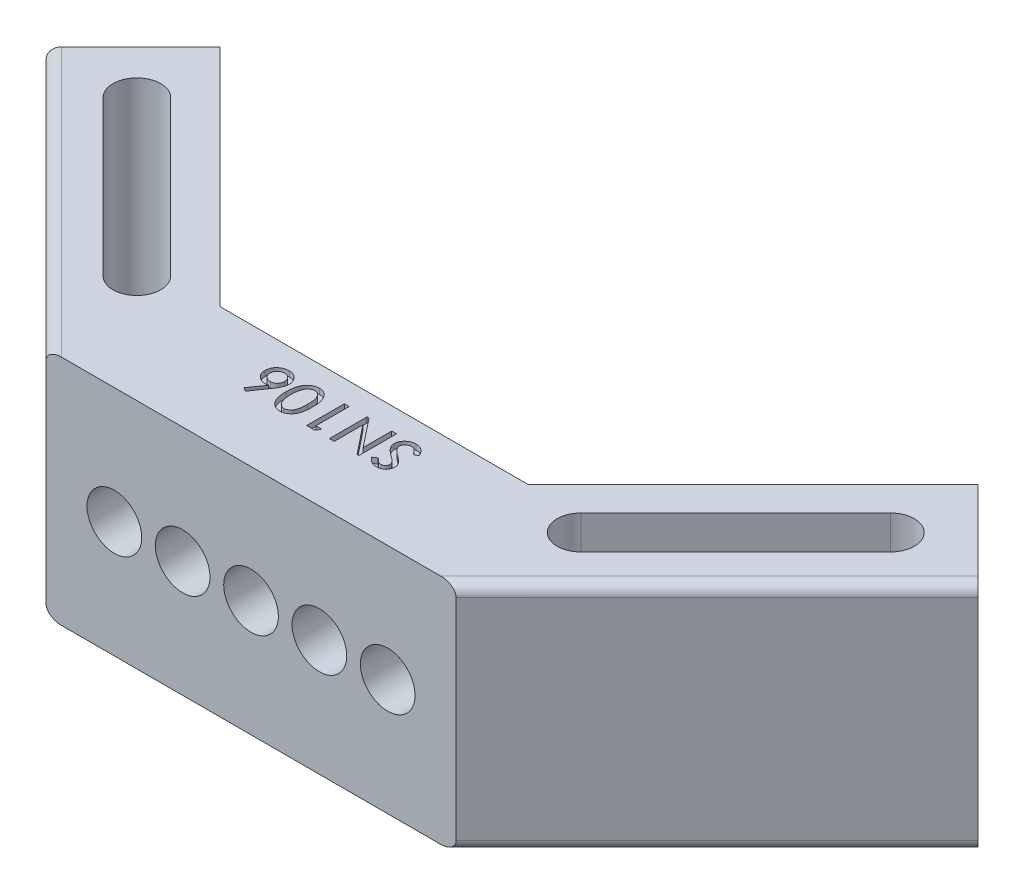
from build123d import *

# Parameters (mm, degrees)
BOSS_EXTRUDE1_DEPTH     = 10.795
CUT_EXTRUDE1_DEPTH      = 50.273729963
CUT_EXTRUDE1_DEPTH_BACK = 50.273729963
SKETCH2_R               = 2.54
FILLET1_R               = 1.016
CUT_EXTRUDE2_DEPTH      = 50.273729963
CUT_EXTRUDE2_DEPTH_BACK = 3.81
SKETCH2_4_R             = 2.54
CUT_EXTRUDE3_DEPTH      = 59.188407756
CUT_EXTRUDE4_DEPTH      = 0.5
CUT_EXTRUDE5_DEPTH      = 0.5


with BuildPart() as part:
    # Sketch1 → Boss-Extrude1 (new, symmetric)
    with BuildSketch(Plane(origin=(0, 0, 0), x_dir=(1, 0, 0), z_dir=(0, 1, 0))):
        Polygon((-43.296691527, 24.246691527), (-19.05, 0), (19.05, 0), (43.296691527, 24.246691527), (35.214461018, 32.328922036), (14.315538982, 11.43), (-14.315538982, 11.43), (-35.214461018, 32.328922036), align=None)
    extrude(amount=BOSS_EXTRUDE1_DEPTH, both=True)

    # Sketch2 → Cut-Extrude1 (cut, two sides: drawn at the far end of the back side and taken through both)
    with BuildSketch(Plane(origin=(0, 0, -11.43), x_dir=(-1, 0, 0), z_dir=(0, 0, -1)).offset(-CUT_EXTRUDE1_DEPTH_BACK)):
        with Locations((-12.7, 0)):
            Circle(SKETCH2_R)
        with Locations((12.7, 0)):
            Circle(SKETCH2_R)
        Circle(SKETCH2_R)
        with Locations((-6.35, 0)):
            Circle(SKETCH2_R)
        with Locations((6.35, 0)):
            Circle(SKETCH2_R)
    extrude(amount=CUT_EXTRUDE1_DEPTH + CUT_EXTRUDE1_DEPTH_BACK, mode=Mode.SUBTRACT)

    # Fillet1
    fillet1_edges = [part.edges().sort_by_distance(p)[0] for p in [
        (-31.173345763, -10.795, -12.123345763),
        (31.173345763, -10.795, -12.123345763),
        (-31.173345763, 10.795, -12.123345763),
        (31.173345763, 10.795, -12.123345763),
    ]]
    fillet(fillet1_edges, radius=FILLET1_R)

    # Sketch2<4> → Cut-Extrude2 (cut, two sides: drawn at the far end of the back side and taken through both)
    with BuildSketch(Plane(origin=(0, 0, -11.43), x_dir=(-1, 0, 0), z_dir=(0, 0, -1)).offset(-CUT_EXTRUDE2_DEPTH_BACK)):
        with BuildLine():
            Line((-12.7, 6.35), (12.7, 6.35))
            ThreePointArc((12.7, 6.35), (19.05, 0), (12.7, -6.35))
            Line((12.7, -6.35), (-12.7, -6.35))
            ThreePointArc((-12.7, -6.35), (-19.05, 0), (-12.7, 6.35))
        make_face()
        Circle(SKETCH2_4_R, mode=Mode.SUBTRACT)
        with Locations((-12.7, 0)):
            Circle(SKETCH2_4_R, mode=Mode.SUBTRACT)
        with Locations((12.7, 0)):
            Circle(SKETCH2_4_R, mode=Mode.SUBTRACT)
        with Locations((-6.35, 0)):
            Circle(SKETCH2_4_R, mode=Mode.SUBTRACT)
        with Locations((6.35, 0)):
            Circle(SKETCH2_4_R, mode=Mode.SUBTRACT)
    extrude(amount=CUT_EXTRUDE2_DEPTH + CUT_EXTRUDE2_DEPTH_BACK, mode=Mode.SUBTRACT)

    # Sketch5 → Cut-Extrude3 (cut, through all)
    with BuildSketch(Plane(origin=(0, 10.795, 0), x_dir=(1, 0, 0), z_dir=(0, 1, 0))):
        with BuildLine():
            ThreePointArc((-22.208240877, 8.456591988), (-19.065151234, 8.456591988), (-19.065151234, 11.599681631))
            Line((-19.065151234, 11.599681631), (-33.433561028, 25.968091424))
            ThreePointArc((-33.433561028, 25.968091424), (-36.57665067, 25.968091424), (-36.57665067, 22.825001782))
            Line((-36.57665067, 22.825001782), (-22.208240877, 8.456591988))
        make_face()
    cut_extrude3 = extrude(amount=-CUT_EXTRUDE3_DEPTH, mode=Mode.SUBTRACT)

    # Mirror1: Cut-Extrude3 across plane
    add(cut_extrude3.mirror(Plane(origin=(0, 0, 0), x_dir=(0, 0, 1), z_dir=(1, 0, 0))), mode=Mode.SUBTRACT)

    # Sketch6 → Cut-Extrude4 (cut)
    # profile 1 of 5: a face of its own
    with BuildSketch(Plane.XZ.offset(10.795)):
        with BuildLine():
            Line((6.142528045, -5.801234276), (6.490985577, -6.010168571))
            Line((6.490985577, -6.010168571), (5.552884615, -7.359126904))
            add(Edge.make_bspline(
                [(5.552884615, -7.359126904), (5.569865057, -7.354125421), (5.606651179, -7.343290298), (5.667993392, -7.333216842), (5.739058295, -7.328140552), (5.78962135, -7.327314516), (5.81650641, -7.326875302)],
                knots=[0, 0, 0, 0, 0.796048766, 1.724545677, 2.790110166, 4, 4, 4, 4], degree=3))
            add(Edge.make_bspline(
                [(5.81650641, -7.326875302), (5.854881834, -7.327787062), (5.93028817, -7.329578639), (6.040666259, -7.344589346), (6.146079588, -7.369232608), (6.246737591, -7.403521121), (6.342339379, -7.448148422), (6.433620482, -7.501264229), (6.518782792, -7.566053626), (6.598427218, -7.639134427), (6.67193822, -7.718048884), (6.735078142, -7.802902886), (6.789478059, -7.890656685), (6.834298152, -7.982293881), (6.867609478, -8.078297481), (6.89237983, -8.177493357), (6.907546882, -8.280635532), (6.909343922, -8.350695683), (6.91025641, -8.386270334)],
                knots=[0, 0, 0, 0, 1.085768624, 2.13349656, 3.1458852, 4.145750037, 5.137155722, 6.127501693, 7.128940571, 8.158980511, 9.184145427, 10.176323106, 11.147419034, 12.102959344, 13.056918676, 14.017869493, 14.993527694, 16, 16, 16, 16], degree=3))
            add(Edge.make_bspline(
                [(6.91025641, -8.386270334), (6.908537041, -8.434779697), (6.905154477, -8.530213554), (6.877330773, -8.6699623), (6.833299717, -8.803639336), (6.770476395, -8.929943927), (6.691131049, -9.048095581), (6.593361861, -9.154390341), (6.479015494, -9.249035256), (6.350342899, -9.331039887), (6.210193634, -9.397355779), (6.062274629, -9.445344451), (5.908142323, -9.475124846), (5.803084579, -9.478840455), (5.74989984, -9.480721455)],
                knots=[0, 0, 0, 0, 0.981999396, 1.931915476, 2.875165147, 3.825883243, 4.780566088, 5.74908454, 6.740839944, 7.779754303, 8.832355466, 9.872951476, 10.923196738, 12, 12, 12, 12], degree=3))
            add(Edge.make_bspline(
                [(5.74989984, -9.480721455), (5.701632194, -9.478955756), (5.605988813, -9.475456984), (5.465492316, -9.447878033), (5.330497672, -9.403457947), (5.202156658, -9.342008962), (5.083844073, -9.263514307), (4.977610712, -9.1701787), (4.88482725, -9.062396412), (4.806825406, -8.941472574), (4.744928771, -8.810936599), (4.699412226, -8.674511366), (4.672016987, -8.533198073), (4.6684583, -8.43733661), (4.666666667, -8.389074821)],
                knots=[0, 0, 0, 0, 1.013919762, 2.009103873, 2.997048414, 3.994509061, 4.990420291, 5.971920342, 6.957603089, 7.969950955, 8.9872563, 9.986070715, 10.986080238, 12, 12, 12, 12], degree=3))
            add(Edge.make_bspline(
                [(4.666666667, -8.389074821), (4.667834773, -8.352095171), (4.670203712, -8.27709986), (4.687021537, -8.163715189), (4.714501732, -8.048317141), (4.746843779, -7.951352379), (4.778225804, -7.871222227), (4.807262385, -7.807934321), (4.839416841, -7.741142016), (4.875859449, -7.671533386), (4.917565635, -7.599744022), (4.962383834, -7.524154776), (5.012206468, -7.446155356), (5.047077929, -7.393205514), (5.064903846, -7.366138122)],
                knots=[0, 0, 0, 0, 1.194305989, 2.422071347, 3.694670561, 5.022004315, 5.720134447, 6.47362152, 7.270449589, 8.114647718, 9.010750929, 9.951985565, 10.953076949, 12, 12, 12, 12], degree=3))
            Line((5.064903846, -7.366138122), (6.142528045, -5.801234276))
        make_face()
        with BuildLine():
            add(Edge.make_bspline(
                [(5.747095353, -7.730721455), (5.72555809, -7.73118182), (5.682984649, -7.732091837), (5.620562068, -7.741676672), (5.560309592, -7.756198629), (5.502821928, -7.777423279), (5.44783817, -7.804158674), (5.395386084, -7.836749861), (5.345495997, -7.875660121), (5.298311968, -7.919828336), (5.255908486, -7.969102635), (5.217241816, -8.020938444), (5.185880586, -8.077198153), (5.160780419, -8.136652887), (5.139982135, -8.198881537), (5.125430153, -8.264645836), (5.116934248, -8.333928803), (5.115908522, -8.381104727), (5.115384615, -8.405200622)],
                knots=[0, 0, 0, 0, 1.000668136, 1.978054791, 2.929484158, 3.878303629, 4.821130496, 5.767956646, 6.743892455, 7.758622191, 8.767575263, 9.763037712, 10.760455477, 11.753542685, 12.760386935, 13.807023548, 14.879900473, 16, 16, 16, 16], degree=3))
            add(Edge.make_bspline(
                [(5.115384615, -8.405200622), (5.115840612, -8.429070815), (5.116733794, -8.475826458), (5.126199513, -8.544384352), (5.14135138, -8.60978121), (5.163543793, -8.671826507), (5.19063223, -8.73109363), (5.224784285, -8.786881564), (5.264790251, -8.839432398), (5.310150613, -8.888233367), (5.359761664, -8.932306676), (5.412389195, -8.970556252), (5.466102602, -9.004106931), (5.52266269, -9.030008655), (5.580421655, -9.051343465), (5.640675088, -9.065840307), (5.702609527, -9.075517099), (5.744720651, -9.076419006), (5.766025641, -9.076875302)],
                knots=[0, 0, 0, 0, 1.099969797, 2.154561419, 3.184363179, 4.189745603, 5.187708984, 6.183808971, 7.198903794, 8.22825443, 9.251098181, 10.253299465, 11.225387826, 12.165412448, 13.116428293, 14.059905273, 15.018461259, 16, 16, 16, 16], degree=3))
            add(Edge.make_bspline(
                [(5.766025641, -9.076875302), (5.789670329, -9.076486125), (5.83624061, -9.075719606), (5.904698153, -9.065151838), (5.970605823, -9.049856491), (6.034220649, -9.02928062), (6.094083135, -9.000377302), (6.151987308, -8.966708885), (6.207463189, -8.926876593), (6.258792703, -8.880493654), (6.306349033, -8.830652282), (6.347728475, -8.777198744), (6.383191575, -8.721463723), (6.412172891, -8.663268557), (6.433743447, -8.602147257), (6.450346895, -8.53893007), (6.459170212, -8.472754489), (6.460742946, -8.42789256), (6.461538462, -8.405200622)],
                knots=[0, 0, 0, 0, 1.054506433, 2.076942642, 3.08409574, 4.073807639, 5.053850104, 6.045100359, 7.061397357, 8.095844899, 9.129029121, 10.132772442, 11.10813953, 12.073918953, 13.02762105, 13.996719216, 14.986705996, 16, 16, 16, 16], degree=3))
            add(Edge.make_bspline(
                [(6.461538462, -8.405200622), (6.460841927, -8.382260311), (6.459470795, -8.33710222), (6.449280146, -8.270640208), (6.433267549, -8.206714256), (6.410797541, -8.145217012), (6.381193793, -8.086575971), (6.344063154, -8.031330701), (6.302175669, -7.977369763), (6.253097003, -7.927831804), (6.20046858, -7.881314442), (6.143322326, -7.841722469), (6.084317271, -7.806866635), (6.022396956, -7.778525465), (5.957288013, -7.757704376), (5.889735571, -7.742377315), (5.819402639, -7.731888171), (5.771439613, -7.731114263), (5.747095353, -7.730721455)],
                knots=[0, 0, 0, 0, 1.007406841, 1.98308429, 2.946696416, 3.898367138, 4.853354566, 5.824321577, 6.818405618, 7.849339281, 8.882723662, 9.899554728, 10.89792352, 11.890309722, 12.883757414, 13.89487152, 14.931514512, 16, 16, 16, 16], degree=3))
        make_face(mode=Mode.SUBTRACT)
    # profile 2 of 5: a face of its own
    with BuildSketch(Plane.XZ.offset(10.795)):
        with BuildLine():
            add(Edge.make_bspline(
                [(1.75, -7.642380109), (1.750334058, -7.586750895), (1.750982811, -7.478716789), (1.757973411, -7.321554835), (1.770032714, -7.174034746), (1.785522465, -7.036152145), (1.806952125, -6.907812297), (1.831472094, -6.788951783), (1.861655425, -6.67955598), (1.89691059, -6.57942968), (1.936495051, -6.486794608), (1.980018353, -6.400490423), (2.027204843, -6.31942138), (2.077735827, -6.243615715), (2.134000258, -6.174762271), (2.192695032, -6.110503018), (2.256024, -6.052092346), (2.323406807, -5.999822683), (2.393110698, -5.95256591), (2.46595987, -5.912734751), (2.540266377, -5.878038017), (2.616977794, -5.84997137), (2.695537927, -5.828168936), (2.776228127, -5.812943082), (2.858664703, -5.802457909), (2.914530432, -5.801643562), (2.942608173, -5.801234276)],
                knots=[0, 0, 0, 0, 1.622528522, 3.151013738, 4.587225782, 5.939257941, 7.196658267, 8.381214254, 9.47772444, 10.503964975, 11.475138444, 12.414102326, 13.321377868, 14.209997518, 15.068075989, 15.912287155, 16.746865696, 17.577313739, 18.397854368, 19.200328723, 19.996378645, 20.787862277, 21.580050128, 22.371504404, 23.181529048, 24, 24, 24, 24], degree=3))
            add(Edge.make_bspline(
                [(2.942608173, -5.801234276), (2.973237922, -5.802040878), (3.033695605, -5.803632969), (3.123417723, -5.81229722), (3.210131667, -5.829801892), (3.295027194, -5.851753431), (3.376729209, -5.88176166), (3.456856126, -5.916269748), (3.532941685, -5.959977472), (3.60758101, -6.007787784), (3.678214939, -6.062922516), (3.745773489, -6.122830262), (3.808150339, -6.18955598), (3.867619238, -6.260803653), (3.921129774, -6.33936363), (3.972070251, -6.42248508), (4.017174791, -6.512238118), (4.059969158, -6.607035016), (4.096753461, -6.709396423), (4.130046774, -6.818737781), (4.157027361, -6.936421355), (4.179408665, -7.06208141), (4.196656635, -7.195929506), (4.209394703, -7.337647699), (4.2160452, -7.487368486), (4.217302923, -7.589790292), (4.217948718, -7.642380109)],
                knots=[0, 0, 0, 0, 0.875057392, 1.727207867, 2.570264412, 3.399251263, 4.229017074, 5.053828049, 5.887584622, 6.731829445, 7.583639997, 8.443960147, 9.308026848, 10.190032267, 11.091770676, 12.020167189, 12.972467704, 13.958579741, 14.989078804, 16.076606933, 17.221320015, 18.435081626, 19.720875061, 21.074561036, 22.497895074, 24, 24, 24, 24], degree=3))
            add(Edge.make_bspline(
                [(4.217948718, -7.642380109), (4.217296154, -7.69473541), (4.216025397, -7.79668845), (4.209470345, -7.94572042), (4.196402124, -8.08666786), (4.180311735, -8.219926374), (4.157742384, -8.345091248), (4.130261609, -8.462228606), (4.099444143, -8.571954321), (4.061771282, -8.673306741), (4.020056507, -8.767991687), (3.974798789, -8.856942179), (3.924954672, -8.940333506), (3.869764482, -9.017260885), (3.811858069, -9.090144906), (3.748719769, -9.156452449), (3.681500256, -9.217447378), (3.61036211, -9.272352899), (3.536119579, -9.321866651), (3.458306924, -9.363662241), (3.378885623, -9.400759989), (3.296082408, -9.428874598), (3.211575786, -9.452868111), (3.123942789, -9.468366639), (3.033996909, -9.478627987), (2.973252796, -9.48001947), (2.942608173, -9.480721455)],
                knots=[0, 0, 0, 0, 1.496607488, 2.914388442, 4.262485651, 5.541812885, 6.749953981, 7.895567619, 8.980172623, 10.005210728, 10.983286874, 11.936336572, 12.856292636, 13.757107149, 14.640766483, 15.514956722, 16.370989637, 17.232841377, 18.081413197, 18.918442167, 19.755471137, 20.583656588, 21.41504191, 22.264086897, 23.124254193, 24, 24, 24, 24], degree=3))
            add(Edge.make_bspline(
                [(2.942608173, -9.480721455), (2.914305371, -9.480240536), (2.858249654, -9.47928804), (2.775474392, -9.469946293), (2.694839409, -9.454442259), (2.616581533, -9.432712694), (2.540150912, -9.405124495), (2.465878998, -9.37170525), (2.394253958, -9.33123863), (2.324592257, -9.285770979), (2.257905619, -9.23405487), (2.195791617, -9.175602721), (2.136756827, -9.111811456), (2.081970768, -9.041993168), (2.030222744, -8.966598563), (1.983572671, -8.884917326), (1.940079665, -8.797821841), (1.899756188, -8.704641261), (1.863347889, -8.603756623), (1.834308991, -8.493194206), (1.806925593, -8.374160455), (1.786830121, -8.245451184), (1.769394702, -8.108037401), (1.759279418, -7.961027072), (1.75063513, -7.804907763), (1.750215591, -7.697549265), (1.75, -7.642380109)],
                knots=[0, 0, 0, 0, 0.82614074, 1.636230647, 2.42850654, 3.22151677, 4.005075515, 4.799112676, 5.596456327, 6.404618302, 7.226350817, 8.05679228, 8.892237205, 9.761873943, 10.645770802, 11.559890835, 12.505927976, 13.487073095, 14.523090282, 15.633895838, 16.822583925, 18.088023083, 19.435493537, 20.865857947, 22.389433785, 24, 24, 24, 24], degree=3))
        make_face()
        with BuildLine():
            add(Edge.make_bspline(
                [(2.198717949, -7.640977866), (2.19889818, -7.687958547), (2.199247094, -7.778909631), (2.204427917, -7.910519842), (2.21180401, -8.033069501), (2.222837456, -8.146525384), (2.237550198, -8.251056192), (2.254964185, -8.346517569), (2.274818745, -8.433092402), (2.299024788, -8.510922954), (2.325827162, -8.58183872), (2.355627953, -8.647125604), (2.386571139, -8.708262693), (2.421427695, -8.764038205), (2.458341648, -8.815214352), (2.49797956, -8.861596334), (2.538926415, -8.904200824), (2.59733787, -8.951509091), (2.672180451, -9.000969834), (2.76508861, -9.043859314), (2.858696861, -9.072170604), (2.921850726, -9.075317122), (2.953125, -9.076875302)],
                knots=[0, 0, 0, 0, 1.564601651, 3.028951736, 4.386019676, 5.653114642, 6.824348509, 7.900668805, 8.88431448, 9.780488761, 10.613163047, 11.407444027, 12.169849642, 12.89344098, 13.595615509, 14.26934431, 14.924332585, 15.560171042, 16.769153194, 17.901006317, 18.960562374, 20, 20, 20, 20], degree=3))
            add(Edge.make_bspline(
                [(2.953125, -9.076875302), (2.988565048, -9.075020955), (3.059224597, -9.071323802), (3.163289116, -9.044403856), (3.263069857, -8.999222517), (3.342131558, -8.948177818), (3.401865865, -8.898530617), (3.445004862, -8.856265981), (3.48476659, -8.809080431), (3.522302958, -8.757692488), (3.556243384, -8.701261518), (3.588969765, -8.641068293), (3.617464309, -8.575668681), (3.633932643, -8.530095286), (3.642327724, -8.506863282)],
                knots=[0, 0, 0, 0, 1.331887272, 2.655486065, 4.012646414, 5.436183829, 6.178803566, 6.930724497, 7.703763371, 8.496530827, 9.320959298, 10.178042319, 11.071218497, 12, 12, 12, 12], degree=3))
            add(Edge.make_bspline(
                [(3.642327724, -8.506863282), (3.652441861, -8.476339728), (3.67306023, -8.414115346), (3.698892212, -8.31723611), (3.720277913, -8.215580672), (3.738692194, -8.109690404), (3.752674184, -7.999031835), (3.762338677, -7.883711554), (3.767882369, -7.76372885), (3.768776306, -7.682349682), (3.769230769, -7.640977866)],
                knots=[0, 0, 0, 0, 0.877617242, 1.789083553, 2.735016418, 3.71249782, 4.722174671, 5.778575778, 6.870664861, 8, 8, 8, 8], degree=3))
            add(Edge.make_bspline(
                [(3.769230769, -7.640977866), (3.769121997, -7.599601813), (3.768909873, -7.518911583), (3.762605322, -7.400881519), (3.754980638, -7.288532649), (3.741826648, -7.182233934), (3.727105272, -7.081454889), (3.706912714, -6.986908023), (3.685255037, -6.897649467), (3.65819829, -6.81478165), (3.628617194, -6.737468684), (3.597417634, -6.665453226), (3.563683172, -6.598677651), (3.52651577, -6.53797982), (3.487287068, -6.48235848), (3.44585071, -6.432148143), (3.40158926, -6.38763143), (3.339710247, -6.337437885), (3.259940433, -6.285197292), (3.160194941, -6.238314112), (3.057197738, -6.210675066), (2.987634842, -6.206935575), (2.953125, -6.20508043)],
                knots=[0, 0, 0, 0, 1.353201578, 2.638969622, 3.865559904, 5.035676431, 6.141732754, 7.195734042, 8.19695873, 9.144657206, 10.044788335, 10.904062871, 11.710933862, 12.489720227, 13.229995877, 13.935715626, 14.616825307, 15.279494989, 16.538995736, 17.725922936, 18.871840505, 20, 20, 20, 20], degree=3))
            add(Edge.make_bspline(
                [(2.953125, -6.20508043), (2.921859744, -6.206669054), (2.858498715, -6.209888504), (2.764748402, -6.237806598), (2.672174702, -6.281036149), (2.597833642, -6.330531127), (2.539905255, -6.377789222), (2.498399384, -6.419424676), (2.460053178, -6.466068745), (2.42304776, -6.516832958), (2.389257698, -6.572975323), (2.356438605, -6.633471693), (2.327522698, -6.699321574), (2.300328962, -6.770291671), (2.276377876, -6.848264466), (2.25566518, -6.934707167), (2.237155882, -7.030062995), (2.223816293, -7.134804761), (2.21260258, -7.248433006), (2.204210323, -7.371174731), (2.199310267, -7.50304964), (2.198919697, -7.59399839), (2.198717949, -7.640977866)],
                knots=[0, 0, 0, 0, 1.039778295, 2.107176824, 3.232337611, 4.43520669, 5.071253539, 5.720927637, 6.389866065, 7.081397607, 7.811854436, 8.571243718, 9.372887587, 10.205834777, 11.102302774, 12.088086757, 13.166194718, 14.33675119, 15.604261439, 16.970055543, 18.43488556, 20, 20, 20, 20], degree=3))
        make_face(mode=Mode.SUBTRACT)
    # profile 3 of 5: a face of its own
    with BuildSketch(Plane.XZ.offset(10.795)):
        Polygon((-0.222956731, -5.890977866), (0.538461538, -5.890977866), (0.538461538, -9.390977866), (0.08974359, -9.390977866), (0.08974359, -6.294824019), (-0.448717949, -6.294824019), align=None)
    # profile 4 of 5: a face of its own
    with BuildSketch(Plane.XZ.offset(10.795)):
        Polygon((-4.307692308, -9.390977866), (-4.307692308, -5.890977866), (-4.141526442, -5.890977866), (-2.019230769, -8.550332834), (-2.019230769, -5.890977866), (-1.570512821, -5.890977866), (-1.570512821, -9.390977866), (-1.754206731, -9.390977866), (-3.858974359, -6.738634116), (-3.858974359, -9.390977866), align=None)
    # profile 5 of 5: a face of its own
    with BuildSketch(Plane.XZ.offset(10.795)):
        with BuildLine():
            Line((-7.134615385, -8.696867289), (-6.753205128, -8.493541968))
            add(Edge.make_bspline(
                [(-6.753205128, -8.493541968), (-6.725409617, -8.539583089), (-6.672284695, -8.627580425), (-6.585050876, -8.746123284), (-6.498316832, -8.847209188), (-6.411226397, -8.930736071), (-6.322569817, -8.995362245), (-6.233252176, -9.042068931), (-6.142714455, -9.071425636), (-6.081498979, -9.075078277), (-6.051382212, -9.076875302)],
                knots=[0, 0, 0, 0, 1.354943589, 2.589672558, 3.704607527, 4.708856974, 5.624398268, 6.459549776, 7.242129862, 8, 8, 8, 8], degree=3))
            add(Edge.make_bspline(
                [(-6.051382212, -9.076875302), (-6.023266588, -9.075971548), (-5.967577627, -9.074181473), (-5.885753554, -9.058657111), (-5.806526185, -9.035003457), (-5.731268385, -9.001321177), (-5.661740516, -8.960056254), (-5.600362691, -8.910973398), (-5.548285318, -8.855404372), (-5.50536149, -8.794103008), (-5.471715232, -8.728651817), (-5.446946422, -8.660908029), (-5.432409601, -8.59067645), (-5.430468422, -8.543387474), (-5.429487179, -8.519483475)],
                knots=[0, 0, 0, 0, 1.0888553, 2.156709112, 3.216967111, 4.287545289, 5.343926646, 6.34269433, 7.323221176, 8.28571565, 9.233736345, 10.167849744, 11.073870434, 12, 12, 12, 12], degree=3))
            add(Edge.make_bspline(
                [(-5.429487179, -8.519483475), (-5.430861992, -8.492240461), (-5.433640174, -8.43718856), (-5.455938534, -8.355408304), (-5.492177438, -8.27442823), (-5.525699241, -8.22386726), (-5.54306891, -8.197668571)],
                knots=[0, 0, 0, 0, 0.941861274, 1.903286225, 2.913566088, 4, 4, 4, 4], degree=3))
            add(Edge.make_bspline(
                [(-5.54306891, -8.197668571), (-5.558088529, -8.178597827), (-5.589706103, -8.138452292), (-5.643225687, -8.078012565), (-5.705850625, -8.014964963), (-5.777479329, -7.949593915), (-5.856852782, -7.880434653), (-5.945319272, -7.809274633), (-6.042253404, -7.734911239), (-6.110182152, -7.685022458), (-6.145332532, -7.659207032)],
                knots=[0, 0, 0, 0, 0.718593868, 1.512701116, 2.388487339, 3.348232282, 4.383172848, 5.504845107, 6.708858268, 8, 8, 8, 8], degree=3))
            add(Edge.make_bspline(
                [(-6.145332532, -7.659207032), (-6.181176719, -7.633149467), (-6.249951677, -7.583152297), (-6.346849586, -7.509856213), (-6.433727993, -7.442273162), (-6.50992068, -7.380350321), (-6.575436306, -7.323549484), (-6.630136857, -7.27210373), (-6.675669048, -7.227424866), (-6.700136749, -7.19736283), (-6.711137821, -7.183846455)],
                knots=[0, 0, 0, 0, 1.435833971, 2.754963323, 3.936484598, 5.002077172, 5.935979083, 6.744956812, 7.435712417, 8, 8, 8, 8], degree=3))
            add(Edge.make_bspline(
                [(-6.711137821, -7.183846455), (-6.727197898, -7.163095272), (-6.758749213, -7.122327902), (-6.79869427, -7.056934402), (-6.833066097, -6.990685052), (-6.861376393, -6.922966427), (-6.883315168, -6.853994863), (-6.898408007, -6.783528483), (-6.909054234, -6.711847192), (-6.909854241, -6.663419651), (-6.91025641, -6.639074821)],
                knots=[0, 0, 0, 0, 1.064105702, 2.090521257, 3.104283852, 4.09061442, 5.065433238, 6.036507983, 7.012940167, 8, 8, 8, 8], degree=3))
            add(Edge.make_bspline(
                [(-6.91025641, -6.639074821), (-6.908989932, -6.601109463), (-6.906482398, -6.525940834), (-6.884074123, -6.416205895), (-6.847761129, -6.311648096), (-6.798194277, -6.212807838), (-6.734898311, -6.121524941), (-6.659610332, -6.039602138), (-6.571922979, -5.968787506), (-6.474175901, -5.909118683), (-6.368816076, -5.86072687), (-6.257847488, -5.826235403), (-6.142615385, -5.805325454), (-6.064322685, -5.802608108), (-6.024739583, -5.801234276)],
                knots=[0, 0, 0, 0, 1.004530234, 1.988896367, 2.951881425, 3.928924249, 4.907494835, 5.884204368, 6.865296418, 7.88218147, 8.909671266, 9.927572845, 10.952225504, 12, 12, 12, 12], degree=3))
            add(Edge.make_bspline(
                [(-6.024739583, -5.801234276), (-5.97979523, -5.802842996), (-5.890782722, -5.806029073), (-5.759569916, -5.827620607), (-5.634098237, -5.866494681), (-5.533044648, -5.909404439), (-5.454544493, -5.953276288), (-5.39517322, -5.992900079), (-5.334320728, -6.037742929), (-5.273914395, -6.090040221), (-5.21159991, -6.147261615), (-5.150568275, -6.212517535), (-5.086957121, -6.282068082), (-5.0464137, -6.332226172), (-5.025641026, -6.357924981)],
                knots=[0, 0, 0, 0, 1.360590218, 2.69465552, 4.010645498, 5.328858611, 6.009843139, 6.729980544, 7.488405022, 8.296451933, 9.147430815, 10.048128915, 10.999946711, 12, 12, 12, 12], degree=3))
            Line((-5.025641026, -6.357924981), (-5.391626603, -6.608926584))
            add(Edge.make_bspline(
                [(-5.391626603, -6.608926584), (-5.410726399, -6.588533171), (-5.447450513, -6.549321756), (-5.501470922, -6.493713978), (-5.552581596, -6.443809972), (-5.600937645, -6.399838032), (-5.64545524, -6.361013975), (-5.687385282, -6.328646956), (-5.725416568, -6.300828973), (-5.772959048, -6.273258283), (-5.831242542, -6.245952682), (-5.902975847, -6.221383904), (-5.978220994, -6.208253403), (-6.029134927, -6.206146252), (-6.054887821, -6.20508043)],
                knots=[0, 0, 0, 0, 1.253377364, 2.409930098, 3.477532466, 4.457083962, 5.341772995, 6.126101147, 6.832963523, 7.453284126, 8.588253012, 9.715448048, 10.844445545, 12, 12, 12, 12], degree=3))
            add(Edge.make_bspline(
                [(-6.054887821, -6.20508043), (-6.082376285, -6.206365023), (-6.135816103, -6.208862377), (-6.2125796, -6.230248013), (-6.283143812, -6.263993816), (-6.345401229, -6.311753165), (-6.397147647, -6.370866451), (-6.435097436, -6.440110178), (-6.457306698, -6.519022609), (-6.460088065, -6.574426298), (-6.461538462, -6.603317609)],
                knots=[0, 0, 0, 0, 1.033513523, 2.009234674, 2.977584268, 3.963375862, 4.942860848, 5.915719707, 6.913112236, 8, 8, 8, 8], degree=3))
            add(Edge.make_bspline(
                [(-6.461538462, -6.603317609), (-6.460973342, -6.622038249), (-6.459844469, -6.659434247), (-6.45155258, -6.714828353), (-6.436225027, -6.768352201), (-6.41680192, -6.821133945), (-6.389616225, -6.872877016), (-6.35499362, -6.923663121), (-6.313893391, -6.974955404), (-6.282350477, -7.007200204), (-6.265925481, -7.023990686)],
                knots=[0, 0, 0, 0, 0.940834015, 1.879392378, 2.805520916, 3.734846727, 4.701501436, 5.734192883, 6.820151034, 8, 8, 8, 8], degree=3))
            add(Edge.make_bspline(
                [(-6.265925481, -7.023990686), (-6.257608805, -7.031814604), (-6.238520292, -7.049772137), (-6.203509907, -7.077270447), (-6.160855211, -7.111745981), (-6.109964858, -7.15263604), (-6.049165457, -7.197720639), (-5.980704978, -7.250011802), (-5.902849995, -7.30715544), (-5.848063226, -7.347217007), (-5.819310897, -7.368241487)],
                knots=[0, 0, 0, 0, 0.485581606, 1.114511607, 1.892484918, 2.819534315, 3.891398566, 5.11240712, 6.484579029, 8, 8, 8, 8], degree=3))
            add(Edge.make_bspline(
                [(-5.819310897, -7.368241487), (-5.780139092, -7.396793724), (-5.70435987, -7.45202902), (-5.596712884, -7.535344195), (-5.499630506, -7.61701356), (-5.41065826, -7.69418786), (-5.332805038, -7.770104406), (-5.264612133, -7.843202263), (-5.205223169, -7.91276794), (-5.141795044, -8.001462231), (-5.078379634, -8.110807055), (-5.021673151, -8.242970819), (-4.987834614, -8.376177199), (-4.983104075, -8.465084716), (-4.980769231, -8.508966648)],
                knots=[0, 0, 0, 0, 1.186540699, 2.295404303, 3.331123753, 4.291760032, 5.17774712, 5.991329992, 6.738459906, 7.414799035, 8.65800623, 9.82461674, 10.926299804, 12, 12, 12, 12], degree=3))
            add(Edge.make_bspline(
                [(-4.980769231, -8.508966648), (-4.981762698, -8.540100238), (-4.983737291, -8.601980629), (-4.998053634, -8.69347475), (-5.021874769, -8.782403896), (-5.056145788, -8.868392551), (-5.098891837, -8.95224774), (-5.151894077, -9.033236349), (-5.214979751, -9.111046296), (-5.285487377, -9.186147759), (-5.36345101, -9.255168932), (-5.447058155, -9.315916667), (-5.536053554, -9.366664987), (-5.629751416, -9.407838439), (-5.727601968, -9.441389689), (-5.830572197, -9.464369489), (-5.938152827, -9.477633769), (-6.011381558, -9.479681381), (-6.048577724, -9.480721455)],
                knots=[0, 0, 0, 0, 0.932646097, 1.853705421, 2.767602683, 3.685675702, 4.622099834, 5.5835355, 6.579838097, 7.620108014, 8.666886363, 9.695041649, 10.711275682, 11.730160242, 12.757671447, 13.80585424, 14.885494678, 16, 16, 16, 16], degree=3))
            add(Edge.make_bspline(
                [(-6.048577724, -9.480721455), (-6.075701591, -9.480119), (-6.129124394, -9.478932411), (-6.20843469, -9.471405668), (-6.285613488, -9.456939342), (-6.361083932, -9.438235841), (-6.434893126, -9.414419457), (-6.506089872, -9.383953935), (-6.575859762, -9.348960074), (-6.643802562, -9.307985887), (-6.710004912, -9.26000834), (-6.774843031, -9.204315844), (-6.837940291, -9.139929395), (-6.900378313, -9.067685508), (-6.961332208, -8.986771588), (-7.020659671, -8.897613108), (-7.07911821, -8.800497577), (-7.115751706, -8.732091577), (-7.134615385, -8.696867289)],
                knots=[0, 0, 0, 0, 0.916943493, 1.805999526, 2.689245248, 3.568702553, 4.433092864, 5.307568578, 6.183755457, 7.069823058, 7.986358083, 8.944343836, 9.955449961, 11.030835633, 12.170024038, 13.377301724, 14.649494474, 16, 16, 16, 16], degree=3))
        make_face()
    extrude(amount=-CUT_EXTRUDE4_DEPTH, mode=Mode.SUBTRACT)

    # Sketch7 → Cut-Extrude5 (cut)
    # profile 1 of 5: a face of its own
    with BuildSketch(Plane(origin=(0, 10.795, 0), x_dir=(1, 0, 0), z_dir=(0, 1, 0))):
        with BuildLine():
            Line((6.955128205, 8.696867289), (6.573717949, 8.493541968))
            add(Edge.make_bspline(
                [(6.573717949, 8.493541968), (6.545922437, 8.539583089), (6.492797515, 8.627580425), (6.405563696, 8.746123284), (6.318829653, 8.847209188), (6.231739217, 8.930736071), (6.143082637, 8.995362245), (6.053764997, 9.042068931), (5.963227276, 9.071425636), (5.9020118, 9.075078277), (5.871895032, 9.076875302)],
                knots=[0, 0, 0, 0, 1.354943589, 2.589672558, 3.704607527, 4.708856974, 5.624398268, 6.459549776, 7.242129862, 8, 8, 8, 8], degree=3))
            add(Edge.make_bspline(
                [(5.871895032, 9.076875302), (5.843777409, 9.075976115), (5.788084486, 9.074195085), (5.706289617, 9.058604042), (5.626860085, 9.035174676), (5.551935483, 9.00048938), (5.48244247, 8.95935991), (5.420674582, 8.910775821), (5.368082166, 8.855622919), (5.325239521, 8.794066052), (5.291507213, 8.728979828), (5.267412618, 8.661058448), (5.252956595, 8.590906704), (5.250989532, 8.543387851), (5.25, 8.519483475)],
                knots=[0, 0, 0, 0, 1.088711937, 2.156425153, 3.216543554, 4.290691142, 5.346933412, 6.339926723, 7.326538423, 8.288906172, 9.236802047, 10.159214894, 11.073992371, 12, 12, 12, 12], degree=3))
            add(Edge.make_bspline(
                [(5.25, 8.519483475), (5.251289441, 8.492214994), (5.253897944, 8.437051594), (5.277544855, 8.35570696), (5.312451573, 8.274232194), (5.346112616, 8.223827276), (5.363581731, 8.197668571)],
                knots=[0, 0, 0, 0, 0.942144539, 1.905933023, 2.913239343, 4, 4, 4, 4], degree=3))
            add(Edge.make_bspline(
                [(5.363581731, 8.197668571), (5.378599068, 8.178595314), (5.410211837, 8.138444487), (5.463771743, 8.078049168), (5.526108213, 8.014918591), (5.598480894, 7.950373777), (5.677065406, 7.880326252), (5.765885722, 7.809335441), (5.862751255, 7.734894267), (5.930689868, 7.685016671), (5.965845353, 7.659207032)],
                knots=[0, 0, 0, 0, 0.718605451, 1.5127255, 2.388525841, 3.34361075, 4.383114545, 5.504804886, 6.708837455, 8, 8, 8, 8], degree=3))
            add(Edge.make_bspline(
                [(5.965845353, 7.659207032), (6.00168954, 7.633149467), (6.070464497, 7.583152297), (6.167362407, 7.509856213), (6.254240814, 7.442273162), (6.3304335, 7.380350321), (6.395949126, 7.323549484), (6.450649678, 7.27210373), (6.496181868, 7.227424866), (6.520649569, 7.19736283), (6.531650641, 7.183846455)],
                knots=[0, 0, 0, 0, 1.435833971, 2.754963323, 3.936484598, 5.002077172, 5.935979083, 6.744956812, 7.435712417, 8, 8, 8, 8], degree=3))
            add(Edge.make_bspline(
                [(6.531650641, 7.183846455), (6.547710719, 7.163095272), (6.579262034, 7.122327902), (6.61920709, 7.056934402), (6.653578917, 6.990685052), (6.681889214, 6.922966427), (6.703827988, 6.853994863), (6.718920828, 6.783528483), (6.729567054, 6.711847192), (6.730367062, 6.663419651), (6.730769231, 6.639074821)],
                knots=[0, 0, 0, 0, 1.064105702, 2.090521257, 3.104283852, 4.09061442, 5.065433238, 6.036507983, 7.012940167, 8, 8, 8, 8], degree=3))
            add(Edge.make_bspline(
                [(6.730769231, 6.639074821), (6.729515083, 6.601104472), (6.727031963, 6.525925959), (6.704399939, 6.416046178), (6.668607851, 6.310920136), (6.617838539, 6.212306218), (6.554959306, 6.121066831), (6.479870762, 6.039381073), (6.392434284, 5.968791115), (6.294689139, 5.909117689), (6.189328785, 5.860727135), (6.078360338, 5.826235332), (5.963128198, 5.805325472), (5.884835503, 5.802608114), (5.845252404, 5.801234276)],
                knots=[0, 0, 0, 0, 1.004538361, 1.98891246, 2.957754601, 3.937604432, 4.916182936, 5.884154884, 6.865254872, 7.882148152, 8.909646262, 9.927556077, 10.952217026, 12, 12, 12, 12], degree=3))
            add(Edge.make_bspline(
                [(5.845252404, 5.801234276), (5.800288489, 5.802743512), (5.711198198, 5.805733871), (5.58029896, 5.828777748), (5.45446477, 5.866212331), (5.353568286, 5.909444093), (5.275055104, 5.953268186), (5.215686682, 5.992902428), (5.154833361, 6.03774224), (5.09442727, 6.090040421), (5.032112714, 6.147261557), (4.9710811, 6.212517551), (4.907469941, 6.282068077), (4.86692652, 6.33222617), (4.846153846, 6.357924981)],
                knots=[0, 0, 0, 0, 1.360687177, 2.696028959, 4.010076158, 5.328383209, 6.009416266, 6.72960499, 7.488083515, 8.296188009, 9.147227534, 10.04798982, 10.999875445, 12, 12, 12, 12], degree=3))
            Line((4.846153846, 6.357924981), (5.212139423, 6.608926584))
            add(Edge.make_bspline(
                [(5.212139423, 6.608926584), (5.231197788, 6.588493045), (5.267953877, 6.549084787), (5.322642771, 6.493896516), (5.373784064, 6.444057522), (5.421450494, 6.399573361), (5.466336542, 6.360962161), (5.508000192, 6.327888619), (5.546973362, 6.301260594), (5.593160244, 6.271920994), (5.651920246, 6.245083088), (5.723895671, 6.221771924), (5.798937681, 6.208126035), (5.849638961, 6.206106546), (5.875400641, 6.20508043)],
                knots=[0, 0, 0, 0, 1.253255604, 2.417037033, 3.484535688, 4.456276324, 5.340879413, 6.139846054, 6.840628373, 7.457335203, 8.592193832, 9.725986821, 10.844557802, 12, 12, 12, 12], degree=3))
            add(Edge.make_bspline(
                [(5.875400641, 6.20508043), (5.902885124, 6.206374437), (5.956317203, 6.208890094), (6.032932005, 6.230088186), (6.103119698, 6.264178759), (6.165194449, 6.311957616), (6.217718177, 6.370617564), (6.255574284, 6.440140864), (6.277829561, 6.519014042), (6.280604327, 6.574423361), (6.282051282, 6.603317609)],
                knots=[0, 0, 0, 0, 1.033786987, 2.00976631, 2.970458119, 3.95651055, 4.942051941, 5.915168215, 6.91282465, 8, 8, 8, 8], degree=3))
            add(Edge.make_bspline(
                [(6.282051282, 6.603317609), (6.28149088, 6.622039999), (6.28037143, 6.659439495), (6.272009308, 6.714807536), (6.256922644, 6.768510246), (6.23645815, 6.820995653), (6.209395004, 6.87268112), (6.175597302, 6.923883995), (6.134357789, 6.974921647), (6.102846717, 7.007188645), (6.086438301, 7.023990686)],
                knots=[0, 0, 0, 0, 0.941102048, 1.879927795, 2.806320176, 3.740133313, 4.70706341, 5.733547381, 6.819814909, 8, 8, 8, 8], degree=3))
            add(Edge.make_bspline(
                [(6.086438301, 7.023990686), (6.078121626, 7.031814604), (6.059033112, 7.049772137), (6.024022728, 7.077270447), (5.981368032, 7.111745981), (5.930477678, 7.15263604), (5.869678278, 7.197720639), (5.801217798, 7.250011802), (5.723362816, 7.30715544), (5.668576046, 7.347217007), (5.639823718, 7.368241487)],
                knots=[0, 0, 0, 0, 0.485581606, 1.114511607, 1.892484918, 2.819534315, 3.891398566, 5.11240712, 6.484579029, 8, 8, 8, 8], degree=3))
            add(Edge.make_bspline(
                [(5.639823718, 7.368241487), (5.600647247, 7.396788565), (5.524859001, 7.45201388), (5.417274927, 7.535398631), (5.320111394, 7.616717379), (5.231859623, 7.694677521), (5.153297125, 7.769840169), (5.085159515, 7.843236538), (5.025718972, 7.91275671), (4.962356185, 8.001482918), (4.898616052, 8.110606646), (4.843298524, 8.243258401), (4.808089766, 8.376047617), (4.80353079, 8.46506055), (4.801282051, 8.508966648)],
                knots=[0, 0, 0, 0, 1.186639563, 2.29559556, 3.331401308, 4.287832086, 5.178002532, 5.991653193, 6.738845359, 7.415240842, 8.658551622, 9.823054859, 10.926210341, 12, 12, 12, 12], degree=3))
            add(Edge.make_bspline(
                [(4.801282051, 8.508966648), (4.802275506, 8.540100251), (4.804250073, 8.601980667), (4.818566607, 8.693474603), (4.842387021, 8.782404443), (4.876660762, 8.868390481), (4.919396348, 8.952255726), (4.972439298, 9.033205208), (5.035257903, 9.11103726), (5.106262482, 9.185424514), (5.183899032, 9.254553913), (5.267788427, 9.31507764), (5.356348148, 9.366809454), (5.450294329, 9.407786722), (5.548106527, 9.441403888), (5.651087312, 9.464365547), (5.758665045, 9.477634804), (5.831894176, 9.47968173), (5.869090545, 9.480721455)],
                knots=[0, 0, 0, 0, 0.932738639, 1.853889356, 2.767877299, 3.686041414, 4.622558463, 5.584089528, 6.580490983, 7.61578374, 8.662665956, 9.690923261, 10.710750907, 11.729736566, 12.757349726, 13.805636525, 14.885384091, 16, 16, 16, 16], degree=3))
            add(Edge.make_bspline(
                [(5.869090545, 9.480721455), (5.896214412, 9.480119), (5.949637214, 9.478932411), (6.028947511, 9.471405668), (6.106126309, 9.456939342), (6.181596753, 9.438235841), (6.255405946, 9.414419457), (6.326602693, 9.383953935), (6.396372582, 9.348960074), (6.464315382, 9.307985887), (6.530517733, 9.26000834), (6.595355852, 9.204315844), (6.658453112, 9.139929395), (6.720891134, 9.067685508), (6.781845028, 8.986771588), (6.841172492, 8.897613108), (6.899631031, 8.800497577), (6.936264526, 8.732091577), (6.955128205, 8.696867289)],
                knots=[0, 0, 0, 0, 0.916943493, 1.805999526, 2.689245248, 3.568702553, 4.433092864, 5.307568578, 6.183755457, 7.069823058, 7.986358083, 8.944343836, 9.955449961, 11.030835633, 12.170024038, 13.377301724, 14.649494474, 16, 16, 16, 16], degree=3))
        make_face()
    # profile 2 of 5: a face of its own
    with BuildSketch(Plane(origin=(0, 10.795, 0), x_dir=(1, 0, 0), z_dir=(0, 1, 0))):
        Polygon((4.128205128, 9.390977866), (4.128205128, 5.890977866), (3.962039263, 5.890977866), (1.83974359, 8.550332834), (1.83974359, 5.890977866), (1.391025641, 5.890977866), (1.391025641, 9.390977866), (1.574719551, 9.390977866), (3.679487179, 6.738634116), (3.679487179, 9.390977866), align=None)
    # profile 3 of 5: a face of its own
    with BuildSketch(Plane(origin=(0, 10.795, 0), x_dir=(1, 0, 0), z_dir=(0, 1, 0))):
        Polygon((0.043469551, 5.890977866), (-0.717948718, 5.890977866), (-0.717948718, 9.390977866), (-0.269230769, 9.390977866), (-0.269230769, 6.294824019), (0.269230769, 6.294824019), align=None)
    # profile 4 of 5: a face of its own
    with BuildSketch(Plane(origin=(0, 10.795, 0), x_dir=(1, 0, 0), z_dir=(0, 1, 0))):
        with BuildLine():
            add(Edge.make_bspline(
                [(-1.929487179, 7.642380109), (-1.929820024, 7.586750652), (-1.930466421, 7.478716074), (-1.937473576, 7.321557433), (-1.949475503, 7.174025864), (-1.965186437, 7.035953116), (-1.985981936, 6.907432951), (-2.01210377, 6.788635779), (-2.041666608, 6.679048389), (-2.077057072, 6.578699599), (-2.116884293, 6.486313454), (-2.159279173, 6.399423792), (-2.207248145, 6.318960169), (-2.258445983, 6.243741734), (-2.313138476, 6.173611131), (-2.372968524, 6.110079872), (-2.436199286, 6.051410826), (-2.503346552, 5.99895724), (-2.573759685, 5.952875359), (-2.645716894, 5.911655363), (-2.720506077, 5.87844393), (-2.796608784, 5.849751377), (-2.875043288, 5.828212221), (-2.955710335, 5.812931245), (-3.038153153, 5.802460933), (-3.094018037, 5.801644573), (-3.122095353, 5.801234276)],
                knots=[0, 0, 0, 0, 1.622605109, 3.151162473, 4.587442309, 5.939538287, 7.20372481, 8.383107478, 9.486239959, 10.512528934, 11.483748244, 12.419707751, 13.330476935, 14.213498841, 15.072700274, 15.92158999, 16.756207925, 17.586695167, 18.403499641, 19.2093348, 20.002585959, 20.787710657, 21.579935901, 22.371427536, 23.181490415, 24, 24, 24, 24], degree=3))
            add(Edge.make_bspline(
                [(-3.122095353, 5.801234276), (-3.152731517, 5.80201154), (-3.213201864, 5.80354572), (-3.302787896, 5.812629688), (-3.389864801, 5.828555035), (-3.474185977, 5.852322446), (-3.556619955, 5.880520216), (-3.63604835, 5.916869037), (-3.713266346, 5.958826771), (-3.787678328, 6.007230744), (-3.858415308, 6.061941934), (-3.925441203, 6.122665584), (-3.988267508, 6.188992519), (-4.046907915, 6.261304443), (-4.101416121, 6.338751065), (-4.151425746, 6.422352243), (-4.197578861, 6.511302619), (-4.240034798, 6.606387504), (-4.277149587, 6.708558059), (-4.309407109, 6.8183864), (-4.336484753, 6.936189476), (-4.358892888, 7.062083659), (-4.376144672, 7.195928854), (-4.388881636, 7.337647887), (-4.395532446, 7.487368435), (-4.396790125, 7.589790275), (-4.397435897, 7.642380109)],
                knots=[0, 0, 0, 0, 0.874832558, 1.726764085, 2.568361456, 3.398879789, 4.226201588, 5.053523386, 5.889679481, 6.733707388, 7.585299078, 8.4404393, 9.313717912, 10.191269597, 11.096596538, 12.015593249, 12.970707924, 13.956566593, 14.986800884, 16.072143337, 17.223061702, 18.436511454, 19.721974523, 21.075312687, 22.498281019, 24, 24, 24, 24], degree=3))
            add(Edge.make_bspline(
                [(-4.397435897, 7.642380109), (-4.396782502, 7.694735202), (-4.395510127, 7.796687836), (-4.388966535, 7.945722679), (-4.375857992, 8.08666001), (-4.359906802, 8.219953422), (-4.336868841, 8.344946776), (-4.311081981, 8.462290936), (-4.278377775, 8.571169614), (-4.241956283, 8.672888531), (-4.200730937, 8.767895408), (-4.153785212, 8.856321484), (-4.104592007, 8.939999833), (-4.050060208, 9.017704151), (-3.991471708, 9.089634494), (-3.928478795, 9.156247305), (-3.861485674, 9.217011905), (-3.790212069, 9.272106234), (-3.715479627, 9.320772857), (-3.638364874, 9.363854803), (-3.558372006, 9.399962028), (-3.47592898, 9.428979517), (-3.391043214, 9.45281715), (-3.303435357, 9.468380541), (-3.213482705, 9.478624419), (-3.152739512, 9.480018274), (-3.122095353, 9.480721455)],
                knots=[0, 0, 0, 0, 1.49659969, 2.914373258, 4.262463443, 5.541784011, 6.749918813, 7.89402581, 8.97408983, 9.996834451, 10.981022981, 11.93120719, 12.856888794, 13.753851156, 14.64171265, 15.506454614, 16.371918745, 17.224394982, 18.078544691, 18.918788586, 19.746969722, 20.583674387, 21.415055378, 22.264095942, 23.124258755, 24, 24, 24, 24], degree=3))
            add(Edge.make_bspline(
                [(-3.122095353, 9.480721455), (-3.09379246, 9.480240728), (-3.037736562, 9.479288614), (-2.954962623, 9.469944069), (-2.874322736, 9.454450402), (-2.796083047, 9.432682391), (-2.719785436, 9.405308632), (-2.645951414, 9.371465345), (-2.574212715, 9.331364032), (-2.504974112, 9.284993568), (-2.438313207, 9.233367387), (-2.375492482, 9.175398345), (-2.316719786, 9.111380215), (-2.26121611, 9.041954202), (-2.209744799, 8.966568994), (-2.163065245, 8.884918341), (-2.119409324, 8.797658264), (-2.07933584, 8.704120925), (-2.043193198, 8.603132275), (-2.012518016, 8.493223081), (-1.986781079, 8.374025208), (-1.966139854, 8.245481206), (-1.949205111, 8.107990437), (-1.937551448, 7.961091101), (-1.930454678, 7.804878267), (-1.929815614, 7.697542984), (-1.929487179, 7.642380109)],
                knots=[0, 0, 0, 0, 0.826227461, 1.636402404, 2.428761462, 3.221854935, 4.005495932, 4.793404576, 5.590831925, 6.402844393, 7.224663165, 8.050552332, 8.895728592, 9.760111832, 10.644101474, 11.558317463, 12.504453911, 13.491971134, 14.528097073, 15.634271589, 16.821614375, 18.087186367, 19.434798266, 20.865849934, 22.389264722, 24, 24, 24, 24], degree=3))
        make_face()
        with BuildLine():
            add(Edge.make_bspline(
                [(-2.378205128, 7.640977866), (-2.378419726, 7.687956009), (-2.378835172, 7.778902179), (-2.383553365, 7.910562008), (-2.392507878, 8.032988228), (-2.402014458, 8.146579306), (-2.417187446, 8.25103044), (-2.43417632, 8.346637084), (-2.455212435, 8.432987852), (-2.479161501, 8.510934728), (-2.506024847, 8.581838094), (-2.535825564, 8.647117804), (-2.566716304, 8.708292472), (-2.601696035, 8.763818319), (-2.637826639, 8.815363451), (-2.677248131, 8.861825334), (-2.719335124, 8.903281213), (-2.777555397, 8.950936918), (-2.852043249, 9.000834874), (-2.944753063, 9.043987396), (-3.038190548, 9.072154824), (-3.101340061, 9.075311896), (-3.132612179, 9.076875302)],
                knots=[0, 0, 0, 0, 1.565050911, 3.029821469, 4.387792543, 5.654509782, 6.826079957, 7.902709307, 8.888453275, 9.784884885, 10.617798265, 11.412307314, 12.174931846, 12.898730956, 13.596561216, 14.270483471, 14.92565982, 15.561680851, 16.775288496, 17.900403612, 18.96026391, 20, 20, 20, 20], degree=3))
            add(Edge.make_bspline(
                [(-3.132612179, 9.076875302), (-3.168054227, 9.075036337), (-3.238491124, 9.07138161), (-3.34261479, 9.044279225), (-3.442241405, 8.998567992), (-3.521609932, 8.947479029), (-3.581382078, 8.897852414), (-3.624246304, 8.855588066), (-3.66449279, 8.80905178), (-3.701752084, 8.757659946), (-3.735741366, 8.701270756), (-3.768453883, 8.641065675), (-3.796952303, 8.575669378), (-3.813420097, 8.530095521), (-3.821814904, 8.506863282)],
                knots=[0, 0, 0, 0, 1.332284016, 2.647757677, 4.016941371, 5.440902831, 6.183743781, 6.935888695, 7.702483601, 8.495487208, 9.320161261, 10.177499591, 11.070941831, 12, 12, 12, 12], degree=3))
            add(Edge.make_bspline(
                [(-3.821814904, 8.506863282), (-3.831929041, 8.476339728), (-3.85254741, 8.414115346), (-3.878379392, 8.31723611), (-3.899765093, 8.215580672), (-3.918179373, 8.109690404), (-3.932161364, 7.999031835), (-3.941825857, 7.883711554), (-3.947369549, 7.76372885), (-3.948263486, 7.682349682), (-3.948717949, 7.640977866)],
                knots=[0, 0, 0, 0, 0.877617242, 1.789083553, 2.735016418, 3.71249782, 4.722174671, 5.778575778, 6.870664861, 8, 8, 8, 8], degree=3))
            add(Edge.make_bspline(
                [(-3.948717949, 7.640977866), (-3.948608725, 7.599601935), (-3.948395719, 7.518911943), (-3.94209743, 7.400880188), (-3.934450595, 7.288537299), (-3.921345323, 7.181988452), (-3.906323118, 7.081099885), (-3.88762759, 6.985971307), (-3.86425341, 6.897218023), (-3.8386314, 6.813935205), (-3.808880154, 6.73696106), (-3.777431111, 6.664945926), (-3.743341134, 6.59860553), (-3.706562256, 6.537705632), (-3.667551009, 6.482090631), (-3.625087361, 6.43234905), (-3.581383507, 6.387139188), (-3.519748428, 6.336309792), (-3.439673756, 6.284577428), (-3.339527163, 6.238441638), (-3.236699524, 6.210638036), (-3.167126865, 6.206923296), (-3.132612179, 6.20508043)],
                knots=[0, 0, 0, 0, 1.352790526, 2.638168002, 3.864385692, 5.034146782, 6.147421261, 7.199576936, 8.202392153, 9.147488116, 10.047345819, 10.899361637, 11.716276266, 12.484327605, 13.224378387, 13.934792477, 14.621120528, 15.277699797, 16.543226194, 17.726613715, 18.872183198, 20, 20, 20, 20], degree=3))
            add(Edge.make_bspline(
                [(-3.132612179, 6.20508043), (-3.101339883, 6.2066538), (-3.037964587, 6.209842335), (-2.94442002, 6.237972874), (-2.851470398, 6.280151836), (-2.777333691, 6.329860865), (-2.719393381, 6.377084468), (-2.677871857, 6.418714217), (-2.639393929, 6.465663287), (-2.60210402, 6.516231847), (-2.568451882, 6.572725923), (-2.536289512, 6.633180542), (-2.506803475, 6.698759624), (-2.479852598, 6.7696079), (-2.455862309, 6.847559628), (-2.435063373, 6.934223659), (-2.4167274, 7.029845292), (-2.403286812, 7.134801707), (-2.392094758, 7.248433922), (-2.38369602, 7.371174459), (-2.378797858, 7.503049716), (-2.378407017, 7.593998416), (-2.378205128, 7.640977866)],
                knots=[0, 0, 0, 0, 1.039553373, 2.106721005, 3.228374519, 4.430983397, 5.066892657, 5.71642622, 6.385219945, 7.087472665, 7.807071781, 8.573169906, 9.367539334, 10.200306343, 11.096580419, 12.082151159, 13.167672988, 14.337976248, 15.605212313, 16.970710972, 18.435224121, 20, 20, 20, 20], degree=3))
        make_face(mode=Mode.SUBTRACT)
    # profile 5 of 5: a face of its own
    with BuildSketch(Plane(origin=(0, 10.795, 0), x_dir=(1, 0, 0), z_dir=(0, 1, 0))):
        with BuildLine():
            Line((-6.322015224, 5.801234276), (-6.670472756, 6.010168571))
            Line((-6.670472756, 6.010168571), (-5.732371795, 7.359126904))
            add(Edge.make_bspline(
                [(-5.732371795, 7.359126904), (-5.749342153, 7.354059933), (-5.785848243, 7.343160028), (-5.847353765, 7.334288347), (-5.918260071, 7.327824677), (-5.969097106, 7.327203794), (-5.99599359, 7.326875302)],
                knots=[0, 0, 0, 0, 0.796198651, 1.712757018, 2.78988236, 4, 4, 4, 4], degree=3))
            add(Edge.make_bspline(
                [(-5.99599359, 7.326875302), (-6.034369967, 7.327785164), (-6.109778178, 7.329573012), (-6.22014274, 7.344610635), (-6.325605225, 7.369156085), (-6.425991108, 7.403770352), (-6.52228103, 7.447073837), (-6.612712097, 7.501743765), (-6.699142471, 7.56499982), (-6.778633591, 7.638248598), (-6.851282717, 7.717833311), (-6.915472366, 7.80173546), (-6.968995625, 7.890346969), (-7.013670116, 7.982106712), (-7.047109055, 8.078294238), (-7.07186364, 8.177494239), (-7.08703494, 8.280635302), (-7.088831397, 8.350695605), (-7.08974359, 8.386270334)],
                knots=[0, 0, 0, 0, 1.085498442, 2.132965663, 3.145102381, 4.144718413, 5.133116042, 6.126588633, 7.129131421, 8.158915047, 9.179356395, 10.175268956, 11.142671319, 12.10392908, 13.05765103, 14.018362725, 14.993778144, 16, 16, 16, 16], degree=3))
            add(Edge.make_bspline(
                [(-7.08974359, 8.386270334), (-7.088024278, 8.434779774), (-7.084641828, 8.530213781), (-7.056817298, 8.669961429), (-7.012789343, 8.803642593), (-6.949954342, 8.929931637), (-6.87065305, 9.048141933), (-6.772837776, 9.15408055), (-6.659403815, 9.249425281), (-6.530078621, 9.329997142), (-6.390434594, 9.39775125), (-6.241917416, 9.445148023), (-6.087645885, 9.475164588), (-5.982577265, 9.478853812), (-5.929387019, 9.480721455)],
                knots=[0, 0, 0, 0, 0.981969745, 1.931857144, 2.875078334, 3.825767723, 4.780421743, 5.748910951, 6.737002066, 7.773346726, 8.8279479, 9.8730157, 10.923229251, 12, 12, 12, 12], degree=3))
            add(Edge.make_bspline(
                [(-5.929387019, 9.480721455), (-5.881118379, 9.478954844), (-5.785473028, 9.475454266), (-5.645209669, 9.447931533), (-5.510263693, 9.403538964), (-5.382655915, 9.34084791), (-5.263196659, 9.263871991), (-5.156908683, 9.170069486), (-5.064507357, 9.061764402), (-4.986486748, 8.940930431), (-4.924252188, 8.810779513), (-4.878925105, 8.674499841), (-4.851497634, 8.533201003), (-4.847943292, 8.437337591), (-4.846153846, 8.389074821)],
                knots=[0, 0, 0, 0, 1.014074239, 2.009409972, 2.992840572, 3.99259211, 4.990059548, 5.971709136, 6.961268766, 7.97377087, 8.98679729, 9.98576388, 10.985925761, 12, 12, 12, 12], degree=3))
            add(Edge.make_bspline(
                [(-4.846153846, 8.389074821), (-4.847321953, 8.352095171), (-4.849690892, 8.27709986), (-4.866508716, 8.163715189), (-4.893988911, 8.048317141), (-4.926330958, 7.951352379), (-4.957712983, 7.871222227), (-4.986749565, 7.807934321), (-5.018904021, 7.741142016), (-5.055346629, 7.671533386), (-5.097052814, 7.599744022), (-5.141871014, 7.524154776), (-5.191693648, 7.446155356), (-5.226565108, 7.393205514), (-5.244391026, 7.366138122)],
                knots=[0, 0, 0, 0, 1.194305989, 2.422071347, 3.694670561, 5.022004315, 5.720134447, 6.47362152, 7.270449589, 8.114647718, 9.010750929, 9.951985565, 10.953076949, 12, 12, 12, 12], degree=3))
            Line((-5.244391026, 7.366138122), (-6.322015224, 5.801234276))
        make_face()
        with BuildLine():
            add(Edge.make_bspline(
                [(-5.926582532, 7.730721455), (-5.905044884, 7.731181065), (-5.862470681, 7.732089592), (-5.800053664, 7.741685311), (-5.739780704, 7.756167205), (-5.68266191, 7.777430922), (-5.627372111, 7.803583051), (-5.575209585, 7.836677574), (-5.525166806, 7.875376985), (-5.478391782, 7.919665081), (-5.435000602, 7.967972432), (-5.397971491, 8.021010516), (-5.365763009, 8.076878372), (-5.340304691, 8.136346252), (-5.319486194, 8.198885687), (-5.304912637, 8.264644682), (-5.296422675, 8.33392911), (-5.295396123, 8.381104831), (-5.294871795, 8.405200622)],
                knots=[0, 0, 0, 0, 1.000694097, 1.97810611, 2.929560161, 3.878404248, 4.806740567, 5.768563649, 6.744524778, 7.743919962, 8.760071517, 9.758047777, 10.746034509, 11.753432514, 12.760302886, 13.806966653, 14.879871413, 16, 16, 16, 16], degree=3))
            add(Edge.make_bspline(
                [(-5.294871795, 8.405200622), (-5.295327834, 8.429070786), (-5.296221098, 8.475826373), (-5.305686221, 8.544384671), (-5.320840266, 8.609780052), (-5.343024782, 8.671830705), (-5.370142327, 8.731078088), (-5.404088579, 8.786781059), (-5.444469103, 8.839046934), (-5.490529636, 8.88733909), (-5.539667534, 8.932055793), (-5.591738953, 8.970922267), (-5.646009965, 9.003092174), (-5.701924356, 9.030235376), (-5.759943787, 9.051273882), (-5.820152819, 9.065859115), (-5.882099151, 9.075512234), (-5.924208651, 9.076417371), (-5.945512821, 9.076875302)],
                knots=[0, 0, 0, 0, 1.100219473, 2.155050473, 3.185085982, 4.190696612, 5.188886516, 6.185212603, 7.191977781, 8.228926169, 9.259187217, 10.252944847, 11.219682184, 12.164542054, 13.115773765, 14.0594649, 15.018238464, 16, 16, 16, 16], degree=3))
            add(Edge.make_bspline(
                [(-5.945512821, 9.076875302), (-5.969158517, 9.076488883), (-6.015730785, 9.075727798), (-6.084173847, 9.065120428), (-6.149918993, 9.050021213), (-6.213336768, 9.028944064), (-6.273437096, 9.000596248), (-6.331460362, 8.966677729), (-6.386955695, 8.926885855), (-6.438273025, 8.880488656), (-6.485857948, 8.830662777), (-6.527138922, 8.777163252), (-6.562899368, 8.721677425), (-6.590597393, 8.662916725), (-6.613491893, 8.602335071), (-6.629756801, 8.538899914), (-6.638677417, 8.472762304), (-6.640236852, 8.427895185), (-6.641025641, 8.405200622)],
                knots=[0, 0, 0, 0, 1.054600619, 2.077128151, 3.084371206, 4.064279055, 5.053859372, 6.045198164, 7.061585936, 8.096125872, 9.129402376, 10.13323535, 11.108689556, 12.069979927, 13.027355563, 13.996540287, 14.986615491, 16, 16, 16, 16], degree=3))
            add(Edge.make_bspline(
                [(-6.641025641, 8.405200622), (-6.640335559, 8.38225779), (-6.638977131, 8.337094736), (-6.628693887, 8.270668898), (-6.61300572, 8.206528988), (-6.589260411, 8.145553292), (-6.560691686, 8.086261384), (-6.523710685, 8.030743596), (-6.481649515, 7.976683604), (-6.43259577, 7.927112838), (-6.379923227, 7.880669053), (-6.323021093, 7.840888459), (-6.263589269, 7.807005927), (-6.201913257, 7.778475071), (-6.136767241, 7.757718135), (-6.069224944, 7.742373518), (-5.998889244, 7.731889165), (-5.950926599, 7.731114597), (-5.926582532, 7.730721455)],
                knots=[0, 0, 0, 0, 1.007251996, 1.982779475, 2.946243488, 3.901359957, 4.851610123, 5.83101817, 6.824949413, 7.855724615, 8.888950157, 9.905624928, 10.898707745, 11.890941411, 12.884236402, 13.895195094, 14.931678746, 16, 16, 16, 16], degree=3))
        make_face(mode=Mode.SUBTRACT)
    extrude(amount=-CUT_EXTRUDE5_DEPTH, mode=Mode.SUBTRACT)


solid = part.part
